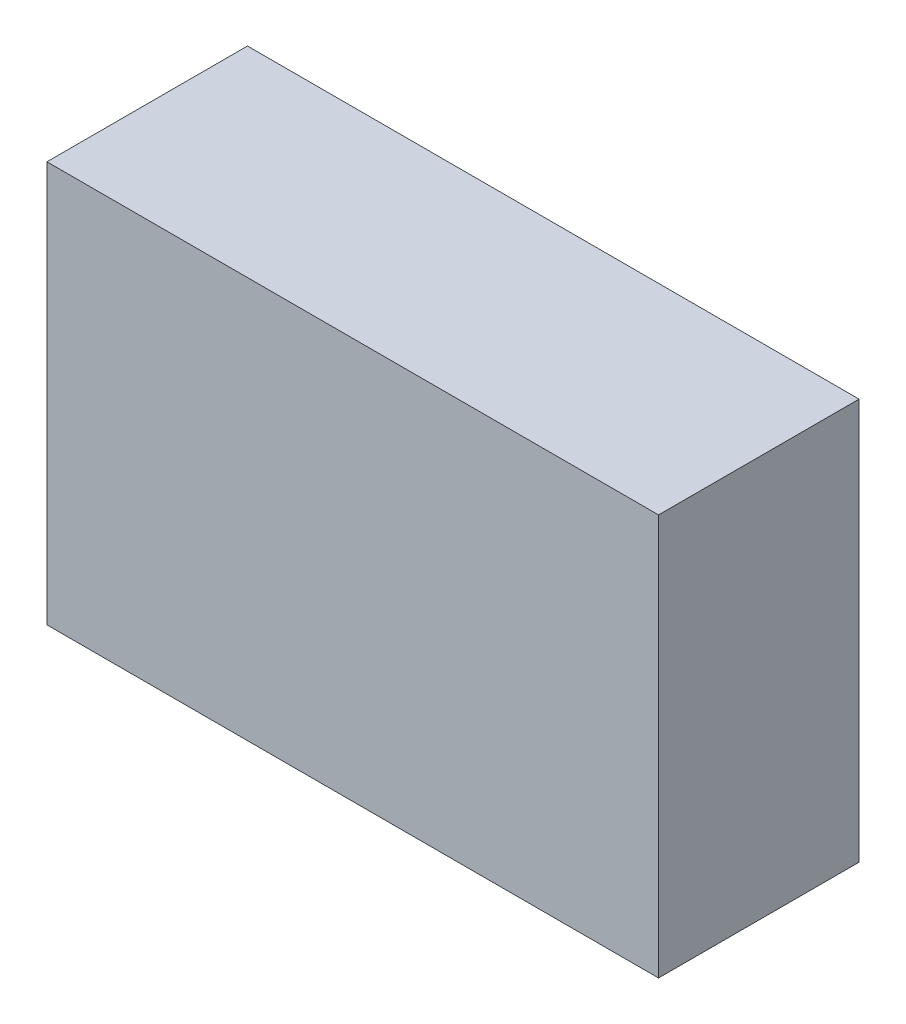
from build123d import *

# Parameters (mm, degrees)
SKETCH1_W           = 61
SKETCH1_H           = 20
BOSS_EXTRUDE1_DEPTH = 40


with BuildPart() as part:
    # Sketch1 → Boss-Extrude1 (new body)
    with BuildSketch(Plane(origin=(0, 0, 0), x_dir=(1, 0, 0), z_dir=(0, 1, 0))):
        with Locations((0.847247706, -2.280963303)):
            Rectangle(SKETCH1_W, SKETCH1_H)
    extrude(amount=BOSS_EXTRUDE1_DEPTH)


solid = part.part
